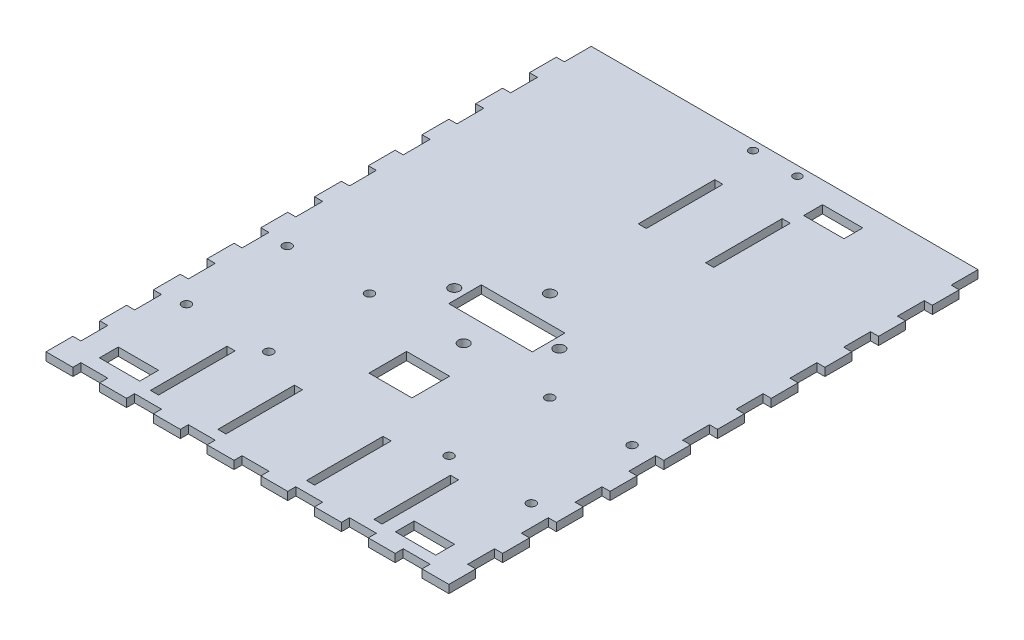
from build123d import *

# Parameters (mm, degrees)
MDFESB_W          = 150
MDFESB_H          = 200
MDF_DEPTH         = 3
LDRESB_W          = 3
LDRESB_H          = 28.5
LDRESB_W_2        = 15
LDRESB_H_2        = 7
LDRBURACOS_DEPTH  = 3
CORESB_R          = 2
CORESB_W          = 31.12
CORESB_H          = 12.13
CORBURACOS_DEPTH  = 3
ENCAIXESESB_W     = 10
ENCAIXESESB_H     = 3
ENCAIXESESB_W_2   = 3
ENCAIXESESB_H_2   = 10
ENCAIXE_DEPTH     = 3
ACOPLMOTORESB_R   = 1.65
ACOPLMOTORESB_W   = 16
ACOPLMOTORESB_H   = 14
ACOPLMOTOR_DEPTH  = 3
CASTERFUROSESB_R  = 1.5
CASTERFUROS_DEPTH = 3


with BuildPart() as part:
    # mdfEsb → mdf (new body)
    with BuildSketch(Plane(origin=(0, 0, 0), x_dir=(1, 0, 0), z_dir=(0, 1, 0))):
        with Locations((75, 100)):
            Rectangle(MDFESB_W, MDFESB_H)
    extrude(amount=MDF_DEPTH)

    # ldrEsb → ldrBuracos (cut)
    with BuildSketch(Plane(origin=(0, 3, 0), x_dir=(1, 0, 0), z_dir=(0, 1, 0))):
        with Locations((33.4, 21.25)):
            Rectangle(LDRESB_W, LDRESB_H)
        with Locations((58.5, 21.25)):
            Rectangle(LDRESB_W, LDRESB_H)
        with Locations((91.5, 21.25)):
            Rectangle(LDRESB_W, LDRESB_H)
        with Locations((116.6, 21.25)):
            Rectangle(LDRESB_W, LDRESB_H)
        with Locations((70.5, 165.75)):
            Rectangle(LDRESB_W, LDRESB_H)
        with Locations((95.6, 165.75)):
            Rectangle(LDRESB_W, LDRESB_H)
        with Locations((130.6, 10.5)):
            Rectangle(LDRESB_W_2, LDRESB_H_2)
        with Locations((19.4, 11.5)):
            Rectangle(LDRESB_W_2, LDRESB_H_2)
        with Locations((104.6, 188.5)):
            Rectangle(LDRESB_W_2, LDRESB_H_2)
    extrude(amount=-LDRBURACOS_DEPTH, mode=Mode.SUBTRACT)

    # corEsb → corBuracos (cut)
    with BuildSketch(Plane(origin=(0, 3, 0), x_dir=(1, 0, 0), z_dir=(0, 1, 0))):
        with Locations(Location((75, 112.63, 0), (0, 0, 270))):
            Circle(CORESB_R)
        with Locations(Location((75, 80.5, 0), (0, 0, 270))):
            Circle(CORESB_R)
        with Locations(Location((94.56, 96.565, 0), (0, 0, 270))):
            Circle(CORESB_R)
        with Locations(Location((55.44, 96.565, 0), (0, 0, 270))):
            Circle(CORESB_R)
        with Locations((75, 96.565)):
            Rectangle(CORESB_W, CORESB_H)
    extrude(amount=-CORBURACOS_DEPTH, mode=Mode.SUBTRACT)

    # EncaixesEsb → Encaixe (cut)
    with BuildSketch(Plane(origin=(0, 3, 0), x_dir=(1, 0, 0), z_dir=(0, 1, 0))):
        with Locations((15, 1.5)):
            Rectangle(ENCAIXESESB_W, ENCAIXESESB_H)
        with Locations((1.5, 35)):
            Rectangle(ENCAIXESESB_W_2, ENCAIXESESB_H_2)
        with Locations((1.5, 15)):
            Rectangle(ENCAIXESESB_W_2, ENCAIXESESB_H_2)
        with Locations((1.5, 55)):
            Rectangle(ENCAIXESESB_W_2, ENCAIXESESB_H_2)
        with Locations((1.5, 75)):
            Rectangle(ENCAIXESESB_W_2, ENCAIXESESB_H_2)
        with Locations((1.5, 95)):
            Rectangle(ENCAIXESESB_W_2, ENCAIXESESB_H_2)
        with Locations((1.5, 115)):
            Rectangle(ENCAIXESESB_W_2, ENCAIXESESB_H_2)
        with Locations((1.5, 135)):
            Rectangle(ENCAIXESESB_W_2, ENCAIXESESB_H_2)
        with Locations((1.5, 155)):
            Rectangle(ENCAIXESESB_W_2, ENCAIXESESB_H_2)
        with Locations((1.5, 175)):
            Rectangle(ENCAIXESESB_W_2, ENCAIXESESB_H_2)
        with Locations((1.5, 195)):
            Rectangle(ENCAIXESESB_W_2, ENCAIXESESB_H_2)
        with Locations((35, 1.5)):
            Rectangle(ENCAIXESESB_W, ENCAIXESESB_H)
        with Locations((55, 1.5)):
            Rectangle(ENCAIXESESB_W, ENCAIXESESB_H)
        with Locations((75, 1.5)):
            Rectangle(ENCAIXESESB_W, ENCAIXESESB_H)
        with Locations((95, 1.5)):
            Rectangle(ENCAIXESESB_W, ENCAIXESESB_H)
        with Locations((115, 1.5)):
            Rectangle(ENCAIXESESB_W, ENCAIXESESB_H)
        with Locations((135, 1.5)):
            Rectangle(ENCAIXESESB_W, ENCAIXESESB_H)
        with Locations((148.5, 35)):
            Rectangle(ENCAIXESESB_W_2, ENCAIXESESB_H_2)
        with Locations((148.5, 15)):
            Rectangle(ENCAIXESESB_W_2, ENCAIXESESB_H_2)
        with Locations((148.5, 55)):
            Rectangle(ENCAIXESESB_W_2, ENCAIXESESB_H_2)
        with Locations((148.5, 75)):
            Rectangle(ENCAIXESESB_W_2, ENCAIXESESB_H_2)
        with Locations((148.5, 95)):
            Rectangle(ENCAIXESESB_W_2, ENCAIXESESB_H_2)
        with Locations((148.5, 115)):
            Rectangle(ENCAIXESESB_W_2, ENCAIXESESB_H_2)
        with Locations((148.5, 135)):
            Rectangle(ENCAIXESESB_W_2, ENCAIXESESB_H_2)
        with Locations((148.5, 155)):
            Rectangle(ENCAIXESESB_W_2, ENCAIXESESB_H_2)
        with Locations((148.5, 175)):
            Rectangle(ENCAIXESESB_W_2, ENCAIXESESB_H_2)
        with Locations((148.5, 195)):
            Rectangle(ENCAIXESESB_W_2, ENCAIXESESB_H_2)
    extrude(amount=-ENCAIXE_DEPTH, mode=Mode.SUBTRACT)

    # AcoplMotorEsb → AcoplMotor (cut)
    with BuildSketch(Plane(origin=(0, 3, 0), x_dir=(1, 0, 0), z_dir=(0, 1, 0))):
        with Locations(Location((108.56, 41.5, 0), (0, 0, 270))):
            Circle(ACOPLMOTORESB_R)
        with Locations(Location((108.56, 79, 0), (0, 0, 270))):
            Circle(ACOPLMOTORESB_R)
        with Locations(Location((139.2, 41.5, 0), (0, 0, 270))):
            Circle(ACOPLMOTORESB_R)
        with Locations(Location((139.2, 79, 0), (0, 0, 270))):
            Circle(ACOPLMOTORESB_R)
        with Locations(Location((10.8, 79, 0), (0, 0, 90))):
            Circle(ACOPLMOTORESB_R)
        with Locations(Location((10.8, 41.5, 0), (0, 0, 90))):
            Circle(ACOPLMOTORESB_R)
        with Locations(Location((41.44, 79, 0), (0, 0, 90))):
            Circle(ACOPLMOTORESB_R)
        with Locations(Location((41.44, 41.5, 0), (0, 0, 90))):
            Circle(ACOPLMOTORESB_R)
        with Locations((75, 60.25)):
            Rectangle(ACOPLMOTORESB_W, ACOPLMOTORESB_H)
    extrude(amount=-ACOPLMOTOR_DEPTH, mode=Mode.SUBTRACT)

    # CasterFurosEsb → CasterFuros (cut)
    with BuildSketch(Plane(origin=(0, 3, 0), x_dir=(1, 0, 0), z_dir=(0, 1, 0))):
        with Locations(Location((66.75, 196.5, 0), (0, 0, 270))):
            Circle(CASTERFUROSESB_R)
        with Locations(Location((83.25, 196.5, 0), (0, 0, 90))):
            Circle(CASTERFUROSESB_R)
    extrude(amount=-CASTERFUROS_DEPTH, mode=Mode.SUBTRACT)


solid = part.part
